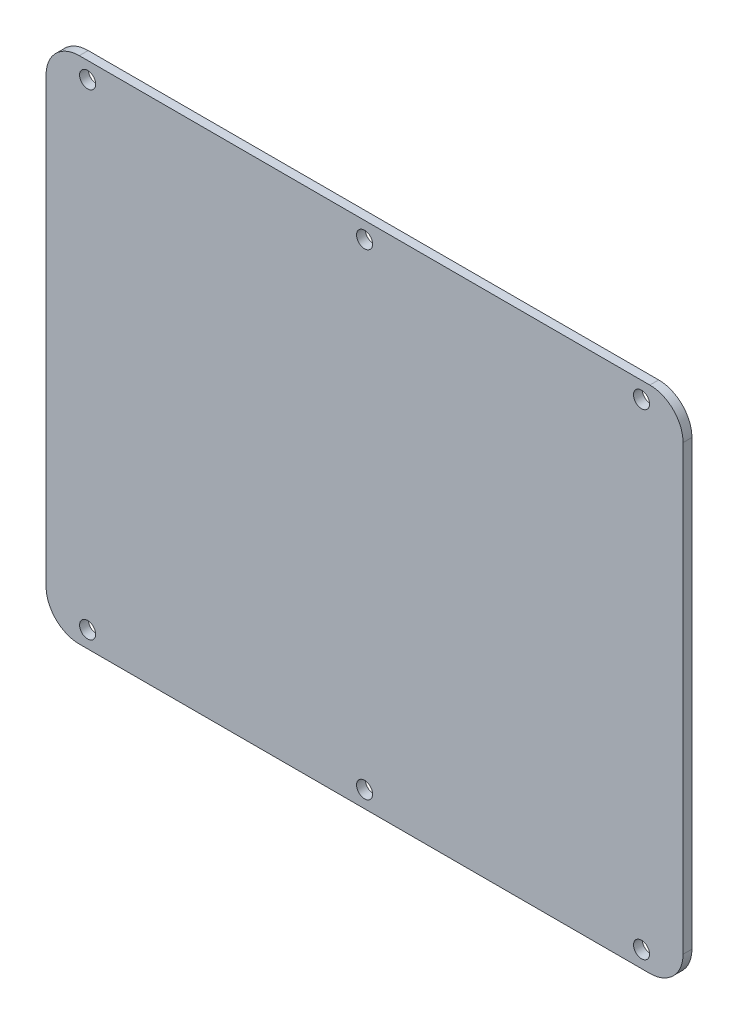
from build123d import *

# Parameters (mm, degrees)
SKETCH1_W              = 115
SKETCH1_H              = 92
BOSS_EXTRUDE1_DEPTH    = 1.6002
M2_5_CLEARANCE_HOLE1_D = 2.9
FILLET2_R              = 6


with BuildPart() as part:
    # Sketch1 → Boss-Extrude1 (new body)
    with BuildSketch(Plane.XY):
        Rectangle(SKETCH1_W, SKETCH1_H)
    extrude(amount=BOSS_EXTRUDE1_DEPTH)

    # M2.5 Clearance Hole1 (through all)
    with Locations(Plane.XY.offset(1.6002)):
        with Locations((50, -43), (-50, 43), (-50, -43), (50, 43), (0, 43), (0, -43)):
            Hole(M2_5_CLEARANCE_HOLE1_D / 2)

    # Fillet2
    fillet2_edges = [part.edges().sort_by_distance(p)[0] for p in [
        (57.5, -46, 0.8001),
        (-57.5, -46, 0.8001),
        (-57.5, 46, 0.8001),
        (57.5, 46, 0.8001),
    ]]
    fillet(fillet2_edges, radius=FILLET2_R)


solid = part.part
